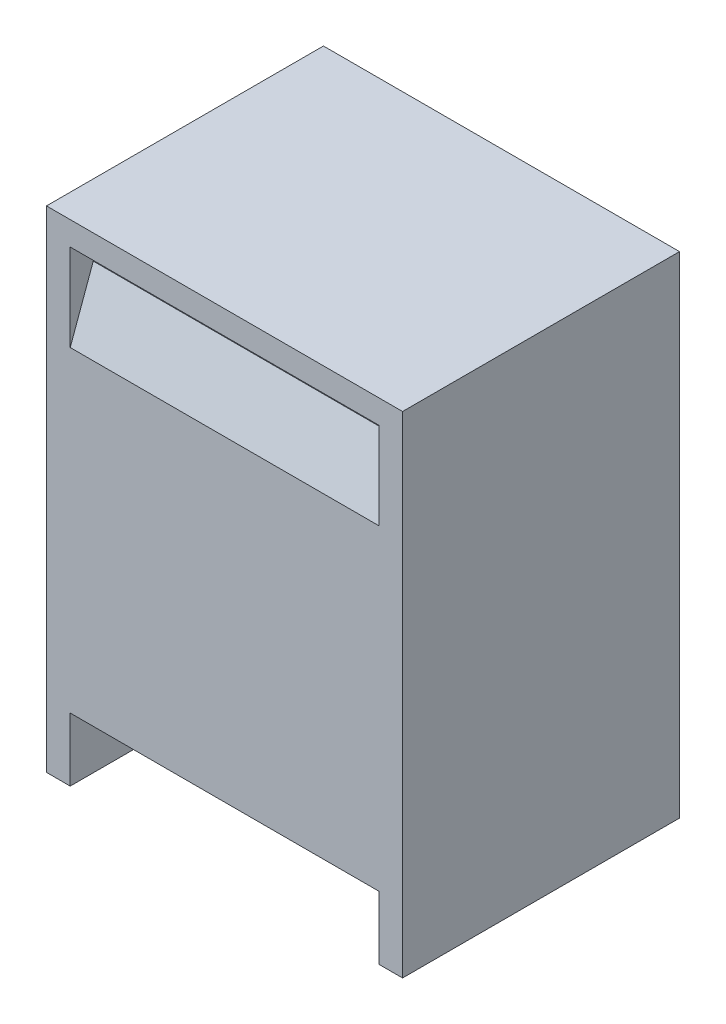
from build123d import *

# Parameters (mm, degrees)
CROQUIS1_W              = 450
CROQUIS1_H              = 620
SALIENTE_EXTRUIR1_DEPTH = 350
CROQUIS2_W              = 390
CROQUIS2_H              = 80
CORTAR_EXTRUIR1_DEPTH   = 350
CROQUIS3_W              = 390
CROQUIS3_H              = 110
CORTAR_EXTRUIR2_DEPTH   = 350
SALIENTE_EXTRUIR2_DEPTH = 420


with BuildPart() as part:
    # Croquis1 → Saliente-Extruir1 (new body)
    with BuildSketch(Plane.XY):
        with Locations((225, 310)):
            Rectangle(CROQUIS1_W, CROQUIS1_H)
    extrude(amount=SALIENTE_EXTRUIR1_DEPTH)

    # Croquis2 → Cortar-Extruir1 (cut)
    with BuildSketch(Plane.XY.offset(350)):
        with Locations((225, 40)):
            Rectangle(CROQUIS2_W, CROQUIS2_H)
    extrude(amount=-CORTAR_EXTRUIR1_DEPTH, mode=Mode.SUBTRACT)

    # Croquis3 → Cortar-Extruir2 (cut)
    with BuildSketch(Plane.XY.offset(350)):
        with Locations((225, 535)):
            Rectangle(CROQUIS3_W, CROQUIS3_H)
    extrude(amount=-CORTAR_EXTRUIR2_DEPTH, mode=Mode.SUBTRACT)

    # Croquis4 → Saliente-Extruir2 (add)
    with BuildSketch(Plane(origin=(30, 0, 0), x_dir=(0, 0, -1), z_dir=(1, 0, 0))):
        Polygon((-350, 480), (-320.882381259, 560), (-29.117618741, 560), (0, 480), (0, 453.27353989), (-350, 453.27353989), align=None)
    extrude(amount=SALIENTE_EXTRUIR2_DEPTH)


solid = part.part
